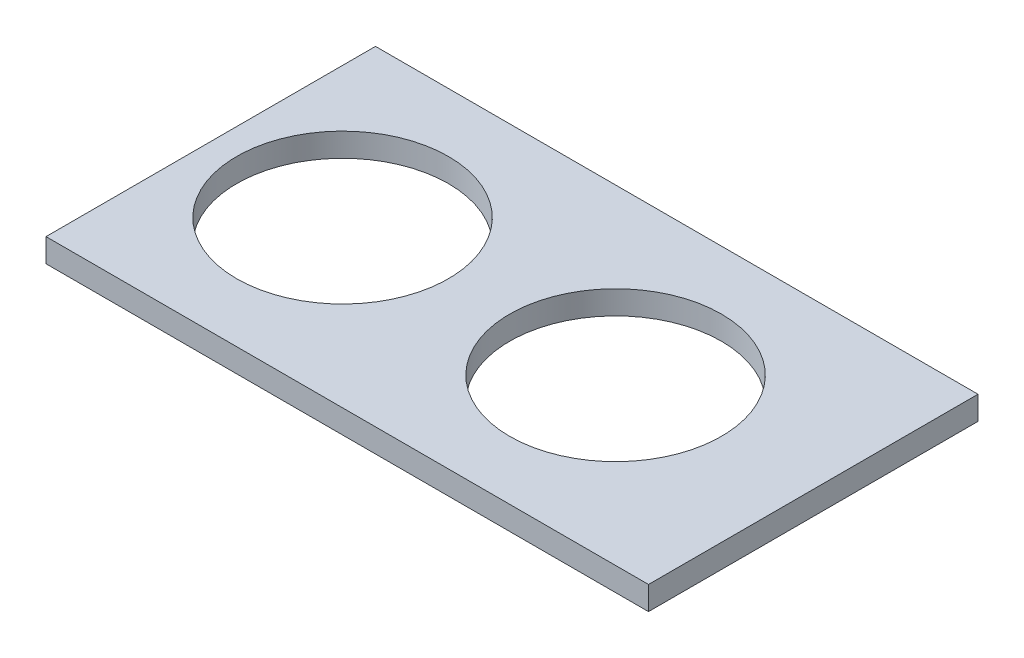
from build123d import *

# Parameters (mm, degrees)
SKETCH1_W           = 81.28
SKETCH1_H           = 44.45
SKETCH1_R           = 14.2875
BOSS_EXTRUDE1_DEPTH = 3.175


with BuildPart() as part:
    # Sketch1 → Boss-Extrude1 (new body)
    with BuildSketch(Plane(origin=(0, 0, 0), x_dir=(1, 0, 0), z_dir=(0, 1, 0))):
        with Locations((22.86, 0)):
            Rectangle(SKETCH1_W, SKETCH1_H)
        with Locations(Location((36.83, 0, 0), (0, 0, 270))):
            Circle(SKETCH1_R, mode=Mode.SUBTRACT)
        with Locations(Location((0, 0, 0), (0, 0, 270))):
            Circle(SKETCH1_R, mode=Mode.SUBTRACT)
    extrude(amount=BOSS_EXTRUDE1_DEPTH)


solid = part.part
